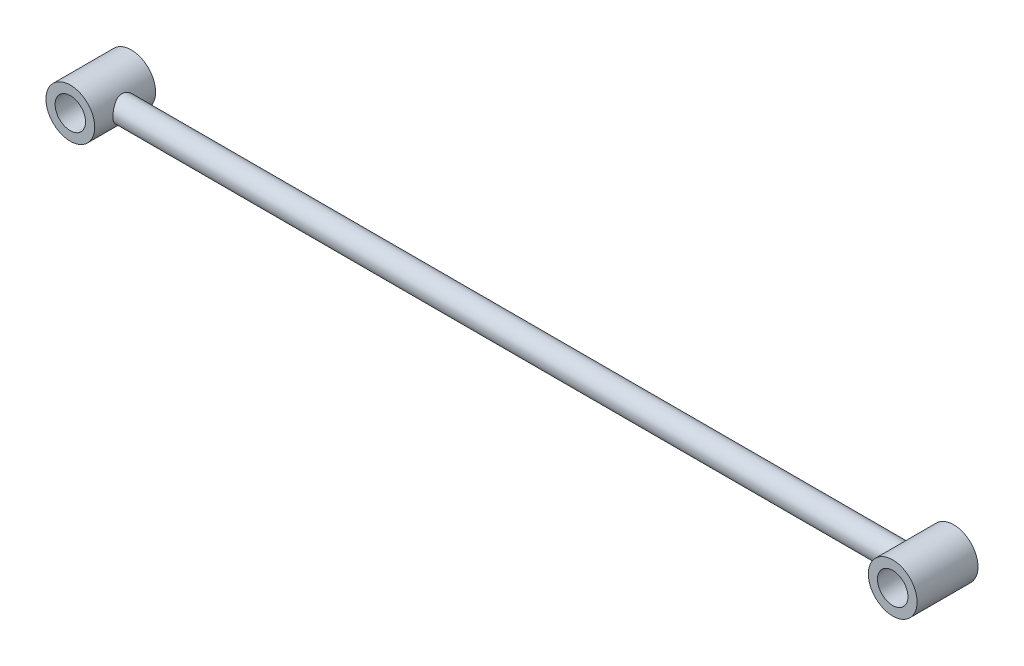
from build123d import *

# Parameters (mm, degrees)
BOSS_EXTRUDE1_DEPTH        = 2.5
BOSS_EXTRUDE1_DEPTH_BACK   = 2.5
SKETCH1_R                  = 2
SKETCH1_R_2                = 1.25
BOSS_EXTRUDE1_2_DEPTH      = 2.5
BOSS_EXTRUDE1_2_DEPTH_BACK = 2.5


with BuildPart() as part:
    # Sketch1 → Boss-Extrude1 (new, two sides: drawn at the far end of the back side and taken through both)
    with BuildSketch(Plane.XY.offset(-BOSS_EXTRUDE1_DEPTH_BACK)):
        Circle(SKETCH1_R)
        Circle(SKETCH1_R_2, mode=Mode.SUBTRACT)
    extrude(amount=BOSS_EXTRUDE1_DEPTH + BOSS_EXTRUDE1_DEPTH_BACK)



with BuildPart() as body_2:
    # Sketch1 → Boss-Extrude1 2 (new, two sides: drawn at the far end of the back side and taken through both)
    with BuildSketch(Plane.XY.offset(-BOSS_EXTRUDE1_2_DEPTH_BACK)):
        with Locations((67.5, 0)):
            Circle(SKETCH1_R)
        with Locations((67.5, 0)):
            Circle(SKETCH1_R_2, mode=Mode.SUBTRACT)
    extrude(amount=BOSS_EXTRUDE1_2_DEPTH + BOSS_EXTRUDE1_2_DEPTH_BACK)


with BuildPart() as part_1:
    add(part.part)

    add(body_2.part)  # Revolve3 merges body 2
    # Sketch2 → Revolve3 (revolve)
    with BuildSketch(Plane.XY):
        with BuildLine():
            ThreePointArc((65.5, 0), (65.568148347, 0.51763809), (65.767949192, 1))
            Line((65.767949192, 1), (1.732050808, 1))
            ThreePointArc((1.732050808, 1), (1.931851653, 0.51763809), (2, 0))
            Line((2, 0), (2.240774351, 0))
            Line((2.240774351, 0), (65.5, 0))
        make_face()
    revolve(axis=Axis((2, 0, 0), (1, 0, 0)))


solid = part_1.part
